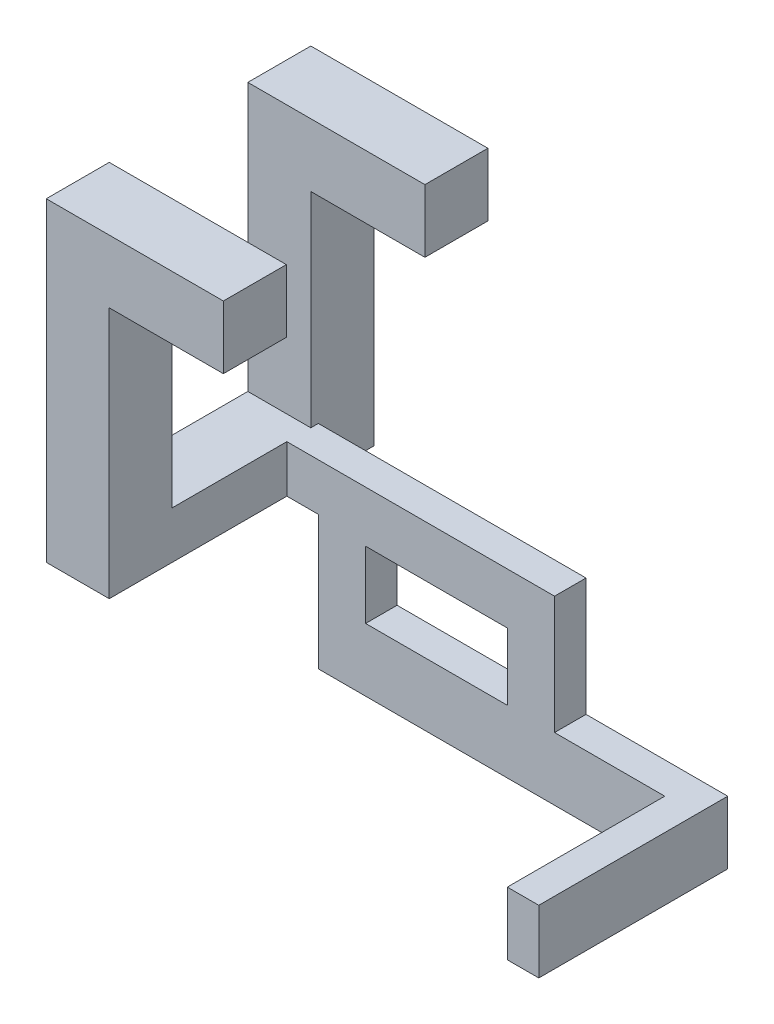
from build123d import *

# Parameters (mm, degrees)
SKETCH2_W                       = 38.1
SKETCH2_H                       = 29.21
BOSS_EXTRUDE1_DEPTH             = 5.08
SKETCH3_W                       = 22.86
SKETCH3_H                       = 12.7
CUT_EXTRUDE1_DEPTH              = 5.08
SKETCH5_W                       = 5.08
SKETCH5_H                       = 7.62
BOSS_EXTRUDE2_DEPTH             = 10.16
SKETCH7_W                       = 5.08
SKETCH7_H                       = 7.62
BOSS_EXTRUDE3_DEPTH             = 18.49
SKETCH8_W                       = 10.16
SKETCH8_H                       = 10.16
BOSS_EXTRUDE4_DEPTH             = 50.8
SKETCH9_W                       = 10.16
SKETCH9_H                       = 10.16
BOSS_EXTRUDE5_DEPTH             = 18.408905777
SKETCH11_W                      = 5.08
SKETCH11_H                      = 10.16
BOSS_EXTRUDE6_DEPTH             = 22.86
BOSS_EXTRUDE6_DIRECTION_2_REACH = 87.569
SKETCH12_W                      = 5.08
SKETCH12_H                      = 10.16
BOSS_EXTRUDE7_DEPTH             = 25.4
SKETCH13_W                      = 22.352
SKETCH13_H                      = 7.62
BOSS_EXTRUDE8_DEPTH             = 5.08


with BuildPart() as part:
    # Sketch2 → Boss-Extrude1 (new body)
    with BuildSketch(Plane.XY):
        Rectangle(SKETCH2_W, SKETCH2_H)
    extrude(amount=BOSS_EXTRUDE1_DEPTH)

    # Sketch3 → Cut-Extrude1 (cut)
    with BuildSketch(Plane.XY.offset(5.08)):
        Rectangle(SKETCH3_W, SKETCH3_H)
    extrude(amount=-CUT_EXTRUDE1_DEPTH, mode=Mode.SUBTRACT)

    # Sketch5 → Boss-Extrude2 (add)
    with BuildSketch(Plane.ZY.offset(19.05)):
        with Locations((2.54, 10.795)):
            Rectangle(SKETCH5_W, SKETCH5_H)
    extrude(amount=BOSS_EXTRUDE2_DEPTH)

    # Sketch7 → Boss-Extrude3 (add)
    with BuildSketch(Plane.XY.offset(5.08)):
        with Locations((-26.67, 10.795)):
            Rectangle(SKETCH7_W, SKETCH7_H)
    extrude(amount=BOSS_EXTRUDE3_DEPTH)

    # Sketch8 → Boss-Extrude4 (add)
    with BuildSketch(Plane.XZ.offset(-6.985)):
        with Locations((-29.21, 28.65)):
            Rectangle(SKETCH8_W, SKETCH8_H)
        with Locations((-29.21, -3.862)):
            Rectangle(SKETCH8_W, SKETCH8_H)
    extrude(amount=-BOSS_EXTRUDE4_DEPTH)

    # Sketch9 → Boss-Extrude5 (add)
    with BuildSketch(Plane(origin=(-24.13, 0, 0), x_dir=(0, 0, -1), z_dir=(1, 0, 0))):
        with Locations((-28.65, 52.705)):
            Rectangle(SKETCH9_W, SKETCH9_H)
        with Locations((3.862, 52.705)):
            Rectangle(SKETCH9_W, SKETCH9_H)
    extrude(amount=BOSS_EXTRUDE5_DEPTH)

    # Sketch11 → Boss-Extrude6 (add)
    with BuildSketch(Plane(origin=(19.05, 0, 0), x_dir=(0, 0, -1), z_dir=(1, 0, 0))):
        with Locations((-2.54, -9.525)):
            Rectangle(SKETCH11_W, SKETCH11_H)
    extrude(amount=BOSS_EXTRUDE6_DEPTH)

    # Sketch11 → Boss-Extrude6 direction 2 (add, up to next)
    with BuildSketch(Plane(origin=(19.05, 0, 0), x_dir=(0, 0, -1), z_dir=(1, 0, 0)), mode=Mode.PRIVATE) as boss_extrude6_direction_2_sk1:
        with Locations((-2.54, -9.525)):
            Rectangle(SKETCH11_W, SKETCH11_H)
    boss_extrude6_direction_2_tool1 = extrude(boss_extrude6_direction_2_sk1.sketch, amount=-BOSS_EXTRUDE6_DIRECTION_2_REACH, mode=Mode.PRIVATE) - part.part
    add(boss_extrude6_direction_2_tool1.solids().sort_by_distance((19.05, -9.525, 2.54))[0])

    # Sketch12 → Boss-Extrude7 (add)
    with BuildSketch(Plane.XY.offset(5.08)):
        with Locations((39.37, -9.525)):
            Rectangle(SKETCH12_W, SKETCH12_H)
    extrude(amount=BOSS_EXTRUDE7_DEPTH)

    # Sketch13 → Boss-Extrude8 (add)
    with BuildSketch(Plane.ZY.offset(29.21)):
        with Locations((12.394, 10.795)):
            Rectangle(SKETCH13_W, SKETCH13_H)
    extrude(amount=BOSS_EXTRUDE8_DEPTH)


solid = part.part
